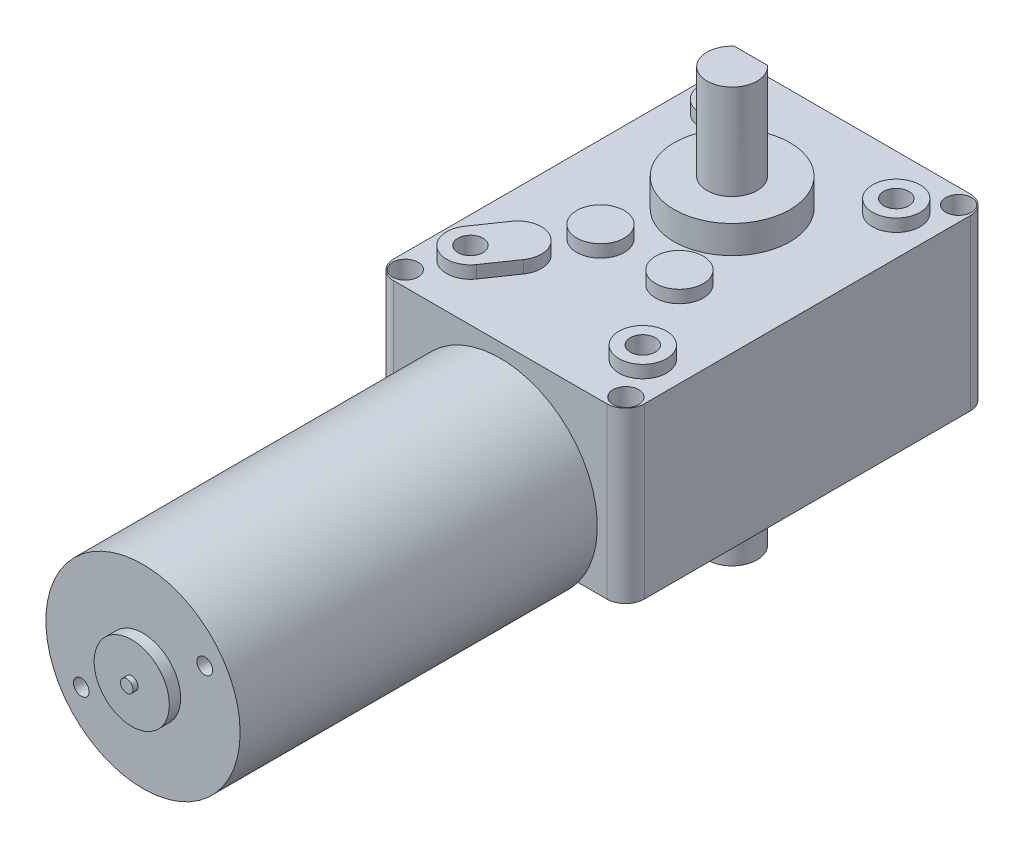
from build123d import *

# Parameters (mm, degrees)
BOSS_EXTRUDE2_DEPTH = 27
SKETCH5_R           = 3.8
BOSS_EXTRUDE3_DEPTH = 2
SKETCH6_R           = 2
CUT_EXTRUDE3_DEPTH  = 4
SKETCH7_R           = 9.25
BOSS_EXTRUDE4_DEPTH = 4.45
SKETCH8_R           = 4
BOSS_EXTRUDE5_DEPTH = 15.14
CUT_EXTRUDE4_START  = -13
CUT_EXTRUDE4_DEPTH  = 13
SKETCH11_R          = 15.5
BOSS_EXTRUDE6_DEPTH = 57
SKETCH12_R          = 6
BOSS_EXTRUDE7_DEPTH = 1.8
SKETCH13_R          = 1
BOSS_EXTRUDE8_DEPTH = 0.8
SKETCH14_R          = 1.25
CUT_EXTRUDE6_DEPTH  = 4
SKETCH10_R          = 2.05
CUT_EXTRUDE5_DEPTH  = 4


with BuildPart() as part:
    # Sketch1 → Boss-Extrude2 (new body)
    with BuildSketch(Plane(origin=(0, 0, 0), x_dir=(1, 0, 0), z_dir=(0, 1, 0))):
        with BuildLine():
            Line((17.005, -29), (-17.005, -29))
            ThreePointArc((-17.005, -29), (-19.126320344, -28.121320344), (-20.005, -26))
            Line((-20.005, -26), (-20.005, 26))
            ThreePointArc((-20.005, 26), (-19.126320344, 28.121320344), (-17.005, 29))
            Line((-17.005, 29), (17.005, 29))
            ThreePointArc((17.005, 29), (19.126320344, 28.121320344), (20.005, 26))
            Line((20.005, 26), (20.005, -26))
            ThreePointArc((20.005, -26), (19.126320344, -28.121320344), (17.005, -29))
        make_face()
    extrude(amount=BOSS_EXTRUDE2_DEPTH)

    # Sketch5 → Boss-Extrude3 (add)
    with BuildSketch(Plane(origin=(0, 27, 0), x_dir=(1, 0, 0), z_dir=(0, 1, 0))):
        with Locations(Location((-13.75, 20.45, 0), (0, 0, 90))):
            Circle(SKETCH5_R)
        with Locations(Location((13.75, 20.45, 0), (0, 0, 90))):
            Circle(SKETCH5_R)
        with Locations(Location((13.75, -20, 0), (0, 0, 90))):
            Circle(SKETCH5_R)
        with Locations(Location((-6.3, -6.7, 0), (0, 0, 90))):
            Circle(SKETCH5_R)
        with Locations(Location((6.3, -6.7, 0), (0, 0, 90))):
            Circle(SKETCH5_R)
        with BuildLine():
            Line((-16.881359312, -17.847190473), (-13.822103668, -13.397364082))
            ThreePointArc((-13.822103668, -13.397364082), (-8.537934829, -12.418814297), (-7.559385044, -17.702983136))
            Line((-7.559385044, -17.702983136), (-10.618640688, -22.152809527))
            ThreePointArc((-10.618640688, -22.152809527), (-15.902809527, -23.131359312), (-16.881359312, -17.847190473))
        make_face()
    boss_extrude3 = extrude(amount=BOSS_EXTRUDE3_DEPTH)

    # Sketch6 → Cut-Extrude3 (cut)
    with BuildSketch(Plane(origin=(0, 29, 0), x_dir=(1, 0, 0), z_dir=(0, 1, 0))):
        with Locations(Location((13.75, -20, 0), (0, 0, 270))):
            Circle(SKETCH6_R)
        with Locations(Location((13.75, 20.45, 0), (0, 0, 270))):
            Circle(SKETCH6_R)
        with Locations(Location((-13.75, 20.45, 0), (0, 0, 270))):
            Circle(SKETCH6_R)
        with Locations(Location((-13.75, -20, 0), (0, 0, 270))):
            Circle(SKETCH6_R)
    cut_extrude3 = extrude(amount=-CUT_EXTRUDE3_DEPTH, mode=Mode.SUBTRACT)

    # Sketch7 → Boss-Extrude4 (add)
    with BuildSketch(Plane(origin=(0, 27, 0), x_dir=(1, 0, 0), z_dir=(0, 1, 0))):
        with Locations(Location((0, 8, 0), (0, 0, 90))):
            Circle(SKETCH7_R)
    boss_extrude4 = extrude(amount=BOSS_EXTRUDE4_DEPTH)

    # Sketch8 → Boss-Extrude5 (add)
    with BuildSketch(Plane(origin=(0, 31.45, 0), x_dir=(1, 0, 0), z_dir=(0, 1, 0))):
        with Locations(Location((0, 8, 0), (0, 0, 270))):
            Circle(SKETCH8_R)
    boss_extrude5 = extrude(amount=BOSS_EXTRUDE5_DEPTH)

    # Sketch9 → Cut-Extrude4 (cut)
    with BuildSketch(Plane(origin=(0, 46.59, 0), x_dir=(1, 0, 0), z_dir=(0, 1, 0)).offset(CUT_EXTRUDE4_START)):
        with BuildLine():
            Line((-2.645751311, 11), (2.645751311, 11))
            ThreePointArc((2.645751311, 11), (0, 12), (-2.645751311, 11))
        make_face()
    cut_extrude4 = extrude(amount=CUT_EXTRUDE4_DEPTH, mode=Mode.SUBTRACT)

    # Mirror1: Boss-Extrude3, Cut-Extrude3, Boss-Extrude4, Boss-Extrude5, Cut-Extrude4 across plane
    add(boss_extrude3.mirror(Plane.ZX.offset(13.5)))
    add(cut_extrude3.mirror(Plane.ZX.offset(13.5)), mode=Mode.SUBTRACT)
    add(boss_extrude4.mirror(Plane.ZX.offset(13.5)))
    add(boss_extrude5.mirror(Plane.ZX.offset(13.5)))
    add(cut_extrude4.mirror(Plane.ZX.offset(13.5)), mode=Mode.SUBTRACT)

    # Sketch11 → Boss-Extrude6 (add)
    with BuildSketch(Plane.XY.offset(29)):
        with Locations(Location((0, 9.3, 0), (0, 0, 216.869897646))):
            Circle(SKETCH11_R)
    extrude(amount=BOSS_EXTRUDE6_DEPTH)

    # Sketch12 → Boss-Extrude7 (add)
    with BuildSketch(Plane.XY.offset(86)):
        with Locations((0, 9.3)):
            Circle(SKETCH12_R)
    extrude(amount=BOSS_EXTRUDE7_DEPTH)

    # Sketch13 → Boss-Extrude8 (add)
    with BuildSketch(Plane.XY.offset(87.8)):
        with Locations((0, 9.3)):
            Circle(SKETCH13_R)
    extrude(amount=BOSS_EXTRUDE8_DEPTH)

    # Sketch14 → Cut-Extrude6 (cut)
    with BuildSketch(Plane.XY.offset(86)):
        with Locations((9.854379173, 15.699508661)):
            Circle(SKETCH14_R)
        with Locations((-9.854379173, 2.900491339)):
            Circle(SKETCH14_R)
    extrude(amount=-CUT_EXTRUDE6_DEPTH, mode=Mode.SUBTRACT)

    # Sketch10 → Cut-Extrude5 (cut)
    with BuildSketch(Plane(origin=(0, 27, 0), x_dir=(1, 0, 0), z_dir=(0, 1, 0))):
        with Locations(Location((-17.6, 26.55, 0), (0, 0, 270))):
            Circle(SKETCH10_R)
        with Locations(Location((17.6, 26.55, 0), (0, 0, 270))):
            Circle(SKETCH10_R)
        with Locations(Location((17.6, -26.55, 0), (0, 0, 270))):
            Circle(SKETCH10_R)
        with Locations(Location((-17.6, -26.55, 0), (0, 0, 270))):
            Circle(SKETCH10_R)
    extrude(amount=-CUT_EXTRUDE5_DEPTH, mode=Mode.SUBTRACT)


solid = part.part
